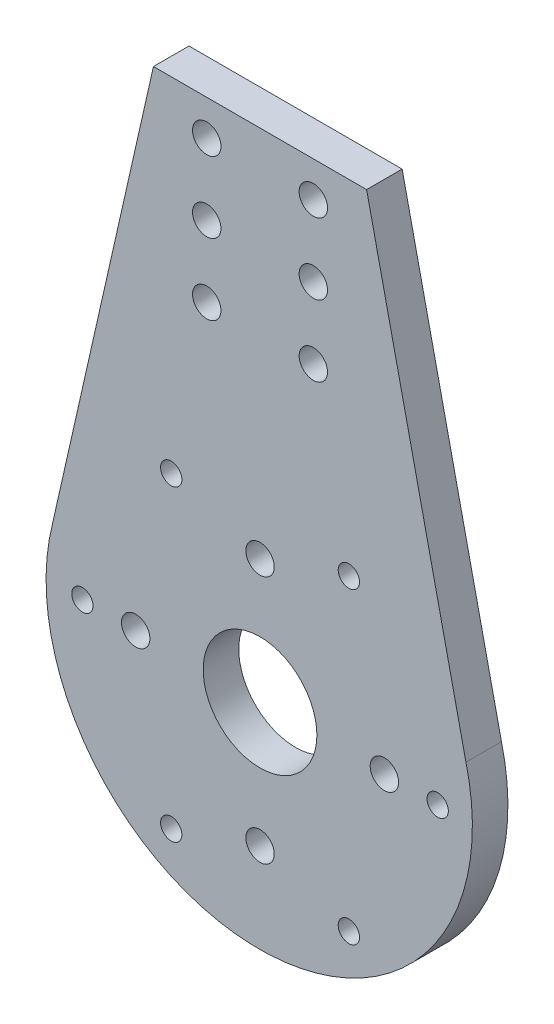
from build123d import *

# Parameters (mm, degrees)
SKETCH1_R           = 1.5
SKETCH1_R_2         = 2
SKETCH1_R_3         = 8
BOSS_EXTRUDE1_DEPTH = 5


with BuildPart() as part:
    # Sketch1 → Boss-Extrude1 (new body)
    with BuildSketch(Plane.XY):
        with BuildLine():
            Line((-15, 70), (-29.20308374, 7.195041803))
            ThreePointArc((-29.20308374, 7.195041803), (-0.112734709, -30.136506004), (28.977614322, 7.195041803))
            Line((28.977614322, 7.195041803), (15, 70))
            Line((15, 70), (-15, 70))
        make_face()
        with Locations((-12.5, -21.650635095)):
            Circle(SKETCH1_R, mode=Mode.SUBTRACT)
        with Locations((0, -17.5)):
            Circle(SKETCH1_R_2, mode=Mode.SUBTRACT)
        with Locations((-25, 0)):
            Circle(SKETCH1_R, mode=Mode.SUBTRACT)
        with Locations((-17.5, 0)):
            Circle(SKETCH1_R_2, mode=Mode.SUBTRACT)
        with Locations((-12.5, 21.650635095)):
            Circle(SKETCH1_R, mode=Mode.SUBTRACT)
        with Locations((12.5, -21.650635095)):
            Circle(SKETCH1_R, mode=Mode.SUBTRACT)
        Circle(SKETCH1_R_3, mode=Mode.SUBTRACT)
        with BuildLine():
            ThreePointArc((0, 15.5), (-2, 17.5), (0, 19.5))
            ThreePointArc((0, 19.5), (2, 17.5), (0, 15.5))
        make_face(mode=Mode.SUBTRACT)
        with Locations((12.5, 21.650635095)):
            Circle(SKETCH1_R, mode=Mode.SUBTRACT)
        with Locations((17.5, 0)):
            Circle(SKETCH1_R_2, mode=Mode.SUBTRACT)
        with Locations((25, 0)):
            Circle(SKETCH1_R, mode=Mode.SUBTRACT)
        with Locations((-7.5, 45)):
            Circle(SKETCH1_R_2, mode=Mode.SUBTRACT)
        with Locations((-7.5, 55)):
            Circle(SKETCH1_R_2, mode=Mode.SUBTRACT)
        with Locations((-7.5, 65)):
            Circle(SKETCH1_R_2, mode=Mode.SUBTRACT)
        with Locations((7.5, 65)):
            Circle(SKETCH1_R_2, mode=Mode.SUBTRACT)
        with Locations((7.5, 55)):
            Circle(SKETCH1_R_2, mode=Mode.SUBTRACT)
        with Locations((7.5, 45)):
            Circle(SKETCH1_R_2, mode=Mode.SUBTRACT)
    extrude(amount=BOSS_EXTRUDE1_DEPTH)


solid = part.part
